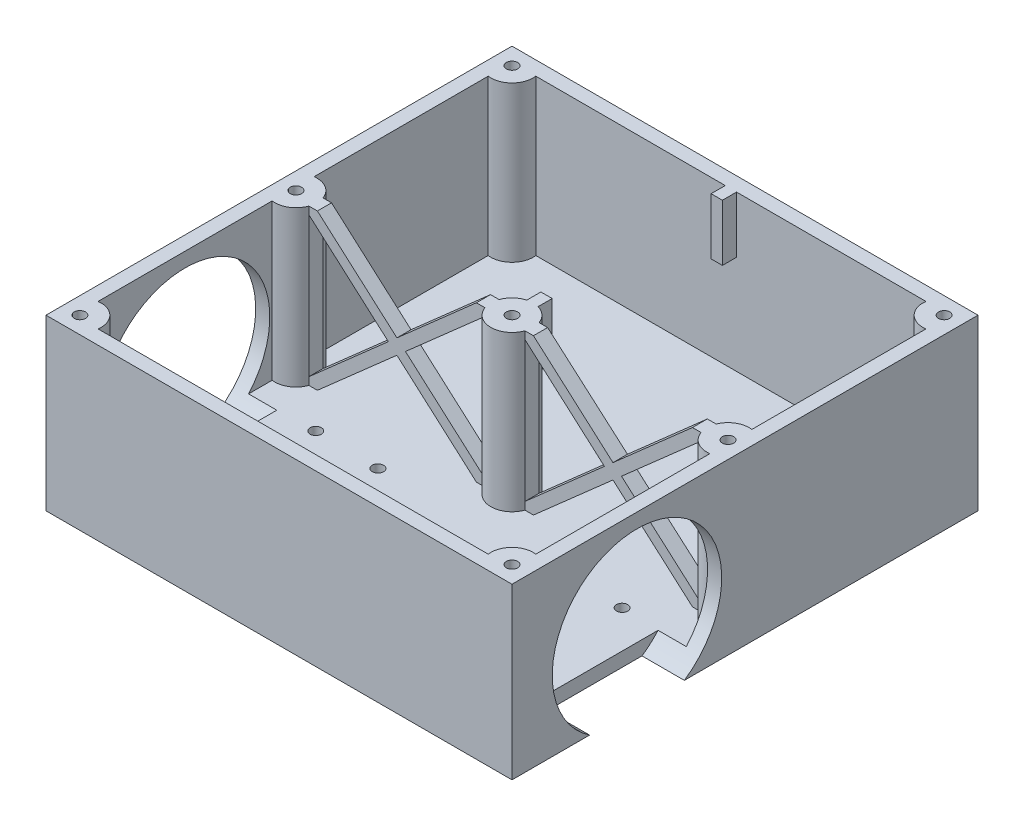
from build123d import *

# Parameters (mm, degrees)
BASE_EXT_DEPTH            = 30
BASE_EXT_DEPTH_BACK       = 25
ESQUISSE1_W               = 165
ESQUISSE1_H               = 165
ESQUISSE1_R               = 2
ESQUISSE2_W               = 165
ESQUISSE2_H               = 165
ESQUISSE2_R               = 5
BASE_BAS_DEPTH            = 5
ACCES_START               = -6
ESQUISSE4_R               = 30
ACCES_ROUES_DEPTH         = 16
ESQUISSE7_R               = 2
VIDE_SUPPORT_MOTEUR_DEPTH = 5
ESQUISSE9_R               = 5
VIS_MOTEUR_10MM_DEPTH     = 2
ESQUISSE10_R              = 2
VIS_PATIN_DEPTH           = 5
VIDE_CROIX_DEPTH          = 11
VIDE_GUIDAGE_REACH        = 123.846


with BuildPart() as part:
    # Esquisse1 → BASE EXT (new, two sides: drawn at the far end of the back side and taken through both)
    with BuildSketch(Plane(origin=(0, 0, 0), x_dir=(1, 0, 0), z_dir=(0, 1, 0)).offset(-BASE_EXT_DEPTH_BACK)):
        Rectangle(ESQUISSE1_W, ESQUISSE1_H)
        with Locations(Location((-76.5, -76.5, 0), (0, 0, 270))):
            Circle(ESQUISSE1_R, mode=Mode.SUBTRACT)
        with Locations(Location((-76.5, 0, 0), (0, 0, 270))):
            Circle(ESQUISSE1_R, mode=Mode.SUBTRACT)
        with Locations(Location((76.5, -76.5, 0), (0, 0, 270))):
            Circle(ESQUISSE1_R, mode=Mode.SUBTRACT)
        with BuildLine():
            ThreePointArc((77.5, -69.066965626), (71.196699141, -71.196699141), (69.066965626, -77.5))
            Line((69.066965626, -77.5), (-69.066965626, -77.5))
            ThreePointArc((-69.066965626, -77.5), (-71.196699141, -71.196699141), (-77.5, -69.066965626))
            Line((-77.5, -69.066965626), (-77.5, -7.433034374))
            ThreePointArc((-77.5, -7.433034374), (-72.588712088, -6.399361443), (-69.428932188, -2.5))
            Line((-69.428932188, -2.5), (-7.071067812, -2.5))
            ThreePointArc((-7.071067812, -2.5), (0, -7.5), (7.071067812, -2.5))
            Line((7.071067812, -2.5), (69.428932188, -2.5))
            ThreePointArc((69.428932188, -2.5), (72.588712088, -6.399361443), (77.5, -7.433034374))
            Line((77.5, -7.433034374), (77.5, -69.066965626))
        make_face(mode=Mode.SUBTRACT)
        with Locations(Location((76.5, 0, 0), (0, 0, 270))):
            Circle(ESQUISSE1_R, mode=Mode.SUBTRACT)
        with BuildLine():
            Line((-7.071067812, 2.5), (-69.428932188, 2.5))
            ThreePointArc((-69.428932188, 2.5), (-72.588712088, 6.399361443), (-77.5, 7.433034374))
            Line((-77.5, 7.433034374), (-77.5, 69.066965626))
            ThreePointArc((-77.5, 69.066965626), (-71.196699141, 71.196699141), (-69.066965626, 77.5))
            Line((-69.066965626, 77.5), (-2, 77.5))
            Line((-2, 77.5), (-2, 7.228416147))
            ThreePointArc((-2, 7.228416147), (-5.114738276, 5.485385344), (-7.071067812, 2.5))
        make_face(mode=Mode.SUBTRACT)
        with Locations(Location((-76.5, 76.5, 0), (0, 0, 270))):
            Circle(ESQUISSE1_R, mode=Mode.SUBTRACT)
        with Locations(Location((0, 0, 0), (0, 0, 270))):
            Circle(ESQUISSE1_R, mode=Mode.SUBTRACT)
        with BuildLine():
            ThreePointArc((77.5, 7.433034374), (72.709235004, 6.471483659), (69.52750715, 2.76303157))
            Line((69.52750715, 2.76303157), (7.071067812, 2.5))
            ThreePointArc((7.071067812, 2.5), (5.114738276, 5.485385344), (2, 7.228416147))
            Line((2, 7.228416147), (2, 77.5))
            Line((2, 77.5), (69.066965626, 77.5))
            ThreePointArc((69.066965626, 77.5), (71.196699141, 71.196699141), (77.5, 69.066965626))
            Line((77.5, 69.066965626), (77.5, 7.433034374))
        make_face(mode=Mode.SUBTRACT)
        with Locations(Location((76.5, 76.5, 0), (0, 0, 270))):
            Circle(ESQUISSE1_R, mode=Mode.SUBTRACT)
    extrude(amount=BASE_EXT_DEPTH + BASE_EXT_DEPTH_BACK)

    # Esquisse2 → BASE BAS (add)
    with BuildSketch(Plane.XZ.offset(25)):
        Rectangle(ESQUISSE2_W, ESQUISSE2_H)
        with Locations(Location((-76.5, 0, 0), (0, 0, 270))):
            Circle(ESQUISSE2_R, mode=Mode.SUBTRACT)
        with Locations(Location((-76.5, -76.5, 0), (0, 0, 270))):
            Circle(ESQUISSE2_R, mode=Mode.SUBTRACT)
        with Locations(Location((76.5, -76.5, 0), (0, 0, 90))):
            Circle(ESQUISSE2_R, mode=Mode.SUBTRACT)
        with Locations(Location((76.5, 0, 0), (0, 0, 90))):
            Circle(ESQUISSE2_R, mode=Mode.SUBTRACT)
        with Locations(Location((76.5, 76.5, 0), (0, 0, 90))):
            Circle(ESQUISSE2_R, mode=Mode.SUBTRACT)
        with Locations(Location((0, 0, 0), (0, 0, 270))):
            Circle(ESQUISSE2_R, mode=Mode.SUBTRACT)
        with Locations(Location((-76.5, 76.5, 0), (0, 0, 270))):
            Circle(ESQUISSE2_R, mode=Mode.SUBTRACT)
    extrude(amount=BASE_BAS_DEPTH)

    # Esquisse4 → ACCES ROUES (cut)
    with BuildSketch(Plane(origin=(-77.5, 0, 0), x_dir=(0, 0, -1), z_dir=(1, 0, 0)).offset(ACCES_START)):
        with Locations((-38.25, -5.128631201)):
            Circle(ESQUISSE4_R)
    acces_roues = extrude(amount=ACCES_ROUES_DEPTH, mode=Mode.SUBTRACT)

    # SYM ACCES ROUE: ACCES ROUES across plane
    add(acces_roues.mirror(Plane(origin=(0, 0, 0), x_dir=(0, 0, 1), z_dir=(1, 0, 0))), mode=Mode.SUBTRACT)

    # Esquisse7 → VIDE SUPPORT MOTEUR (cut)
    with BuildSketch(Plane(origin=(0, -25, 0), x_dir=(1, 0, 0), z_dir=(0, 1, 0))):
        with Locations(Location((54.232363064, -61.25, 0), (0, 0, 270))):
            Circle(ESQUISSE7_R)
        with Locations(Location((31.732363064, -60.75, 0), (0, 0, 270))):
            Circle(ESQUISSE7_R)
        with Locations(Location((31.732363064, -15.75, 0), (0, 0, 270))):
            Circle(ESQUISSE7_R)
        with Locations(Location((54.232363064, -15.25, 0), (0, 0, 270))):
            Circle(ESQUISSE7_R)
        with Locations(Location((-54.232363064, -15.25, 0), (0, 0, 270))):
            Circle(ESQUISSE7_R)
        with Locations(Location((-31.732363064, -15.75, 0), (0, 0, 270))):
            Circle(ESQUISSE7_R)
        with Locations(Location((-31.732363064, -60.75, 0), (0, 0, 270))):
            Circle(ESQUISSE7_R)
        with Locations(Location((-54.232363064, -61.25, 0), (0, 0, 270))):
            Circle(ESQUISSE7_R)
    extrude(amount=-VIDE_SUPPORT_MOTEUR_DEPTH, mode=Mode.SUBTRACT)

    # Esquisse9 → VIS MOTEUR 10mm (cut)
    with BuildSketch(Plane.XZ.offset(30)):
        with Locations(Location((-54.232363064, 61.25, 0), (0, 0, 270))):
            Circle(ESQUISSE9_R)
        with Locations(Location((-31.732363064, 60.75, 0), (0, 0, 270))):
            Circle(ESQUISSE9_R)
        with Locations(Location((-54.232363064, 15.25, 0), (0, 0, 270))):
            Circle(ESQUISSE9_R)
        with Locations(Location((-31.732363064, 15.75, 0), (0, 0, 270))):
            Circle(ESQUISSE9_R)
        with Locations(Location((31.732363064, 15.75, 0), (0, 0, 90))):
            Circle(ESQUISSE9_R)
        with Locations(Location((54.232363064, 15.25, 0), (0, 0, 90))):
            Circle(ESQUISSE9_R)
        with Locations(Location((31.732363064, 60.75, 0), (0, 0, 90))):
            Circle(ESQUISSE9_R)
        with Locations(Location((54.232363064, 61.25, 0), (0, 0, 90))):
            Circle(ESQUISSE9_R)
    extrude(amount=-VIS_MOTEUR_10MM_DEPTH, mode=Mode.SUBTRACT)

    # Esquisse10 → VIS PATIN (cut)
    with BuildSketch(Plane.XZ.offset(30)):
        with Locations(Location((-42.5, -52.5, 0), (0, 0, 270))):
            Circle(ESQUISSE10_R)
        with Locations(Location((42.5, -52.5, 0), (0, 0, 270))):
            Circle(ESQUISSE10_R)
    extrude(amount=-VIS_PATIN_DEPTH, mode=Mode.SUBTRACT)

    # Esquisse11 → VIDE CROIX (cut)
    with BuildSketch(Plane.XY.offset(2.5)):
        Polygon((-69.428932188, 27.333215955), (-41.273544688, 2.5), (-69.428932188, -22.333215955), align=None)
        Polygon((-66.4053875, 30), (-38.25, 5.166784045), (-10.0946125, 30), align=None)
        Polygon((-7.071067812, -22.333215955), (-7.071067812, 27.333215955), (-35.226455312, 2.5), align=None)
        Polygon((-10.0946125, -25), (-66.4053875, -25), (-38.25, -0.166784045), align=None)
        Polygon((66.4053875, -25), (38.25, -0.166784045), (10.0946125, -25), align=None)
        Polygon((7.071067812, 27.333215955), (35.226455312, 2.5), (7.071067812, -22.333215955), align=None)
        Polygon((69.428932188, -22.333215955), (69.428932188, 27.333215955), (41.273544688, 2.5), align=None)
        Polygon((10.0946125, 30), (66.4053875, 30), (38.25, 5.166784045), align=None)
    extrude(amount=-VIDE_CROIX_DEPTH, mode=Mode.SUBTRACT)

    # VIDE GUIDAGE: up to this face of the body (flat: up to its plane)
    vide_guidage_end = Plane(part.part.faces().sort_by_distance((2, 2.5, -42.364208074))[0])
    # Esquisse12 → VIDE GUIDAGE (cut, up to the picked face)
    with BuildSketch(Plane.ZY.offset(2), mode=Mode.PRIVATE) as vide_guidage_sk1:
        Polygon((-7.228416147, 10), (-12.228416147, 10), (-12.228416147, 30), (-72.5, 30), (-72.5, 10), (-77.5, 10), (-77.5, -25), (-7.228416147, -25), align=None)
    vide_guidage_tool1 = split(extrude(vide_guidage_sk1.sketch, amount=-VIDE_GUIDAGE_REACH, mode=Mode.PRIVATE), bisect_by=vide_guidage_end, keep=Keep.BOTH, mode=Mode.PRIVATE)
    add(vide_guidage_tool1.solids().sort_by(Axis((-2, 1.545004, -42.364208), (1, 0, 0)))[0], mode=Mode.SUBTRACT)


solid = part.part
